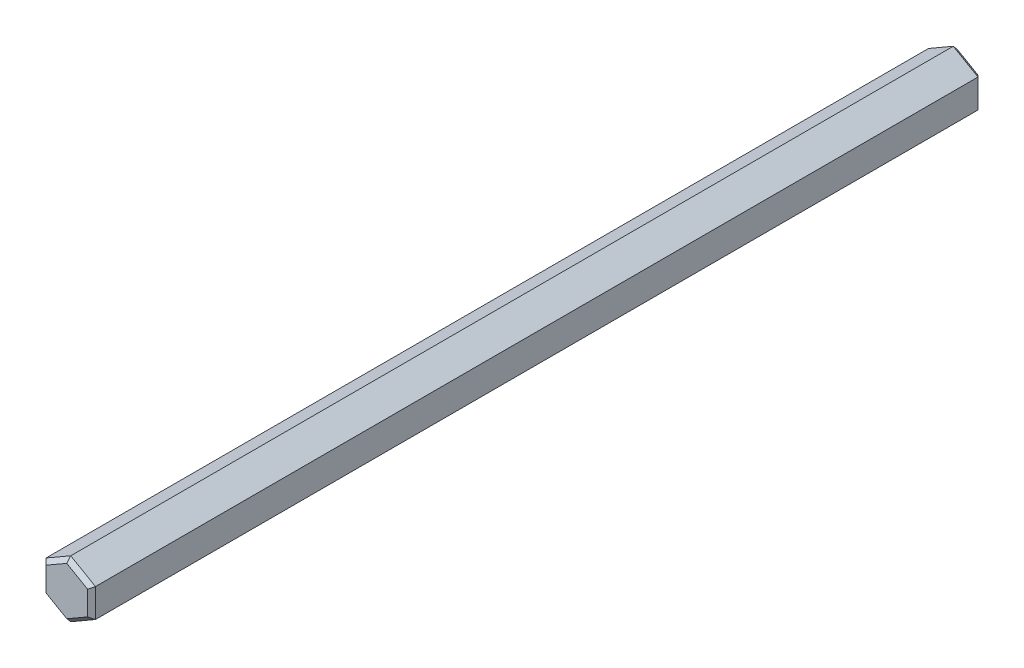
from build123d import *

# Parameters (mm, degrees)
BOSS_EXTRUDE1_DEPTH = 90
CHAMFER1_SIZE       = 0.4


with BuildPart() as part:
    # Sketch1 → Boss-Extrude1 (new body)
    with BuildSketch(Plane(origin=(0, 0, -45), x_dir=(-1, 0, 0), z_dir=(0, 0, -1))):
        Polygon((0, -2.886751346), (2.5, -1.443375673), (2.5, 1.443375673), (0, 2.886751346), (-2.5, 1.443375673), (-2.5, -1.443375673), align=None)
    extrude(amount=-BOSS_EXTRUDE1_DEPTH)

    # Chamfer1
    chamfer1_edges = [part.edges().sort_by_distance(p)[0] for p in [
        (-2.5, 0, 45),
        (-1.25, 2.165063509, 45),
        (1.25, 2.165063509, 45),
        (2.5, 0, 45),
        (1.25, -2.165063509, 45),
        (2.5, 0, -45),
        (1.25, 2.165063509, -45),
        (-1.25, 2.165063509, -45),
        (-1.25, -2.165063509, 45),
        (-2.5, 0, -45),
        (-1.25, -2.165063509, -45),
        (1.25, -2.165063509, -45),
    ]]
    chamfer(chamfer1_edges, length=CHAMFER1_SIZE)


solid = part.part
